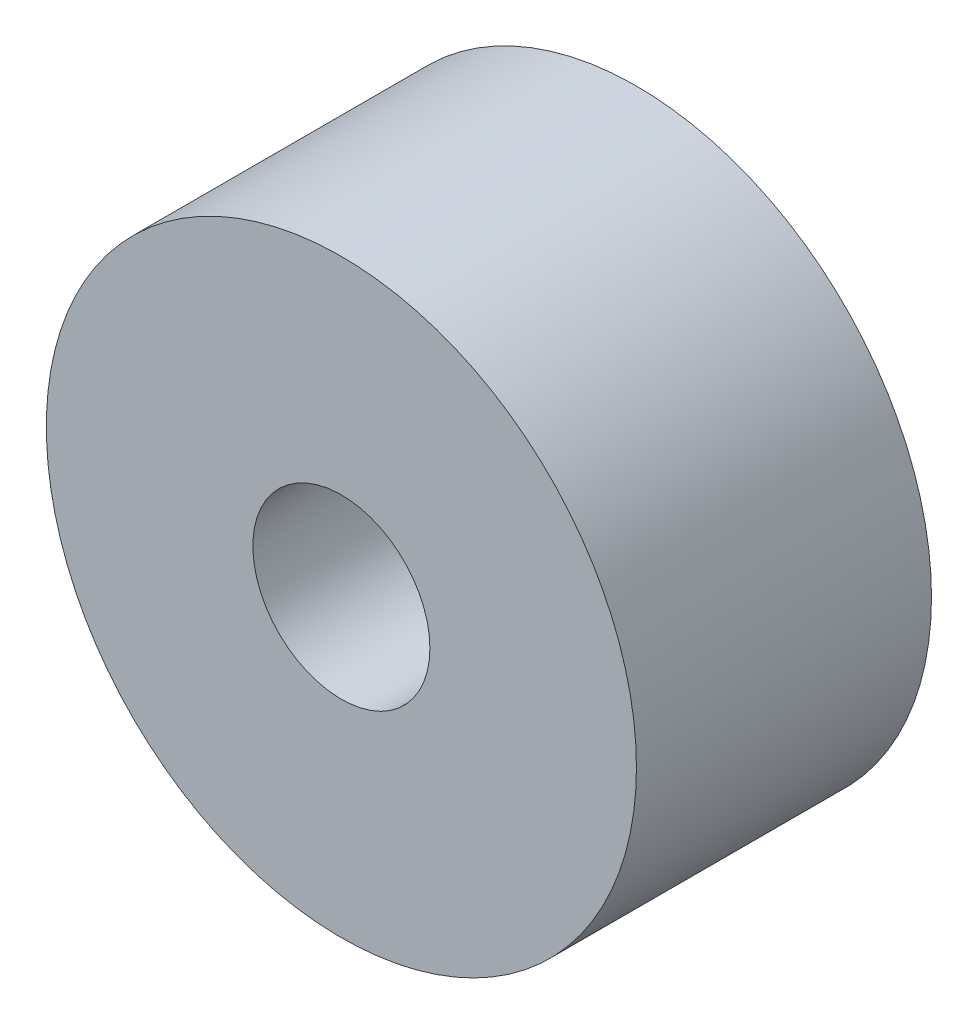
from build123d import *

# Parameters (mm, degrees)
SKETCH_1_R      = 2.5
SKETCH_1_R_2    = 0.75
EXTRUDE_1_DEPTH = 2.5


with BuildPart() as part:
    # 草图1 → 凸台-拉伸1 (new body)
    with BuildSketch(Plane.XY):
        Circle(SKETCH_1_R)
        Circle(SKETCH_1_R_2, mode=Mode.SUBTRACT)
    extrude(amount=EXTRUDE_1_DEPTH)


solid = part.part
